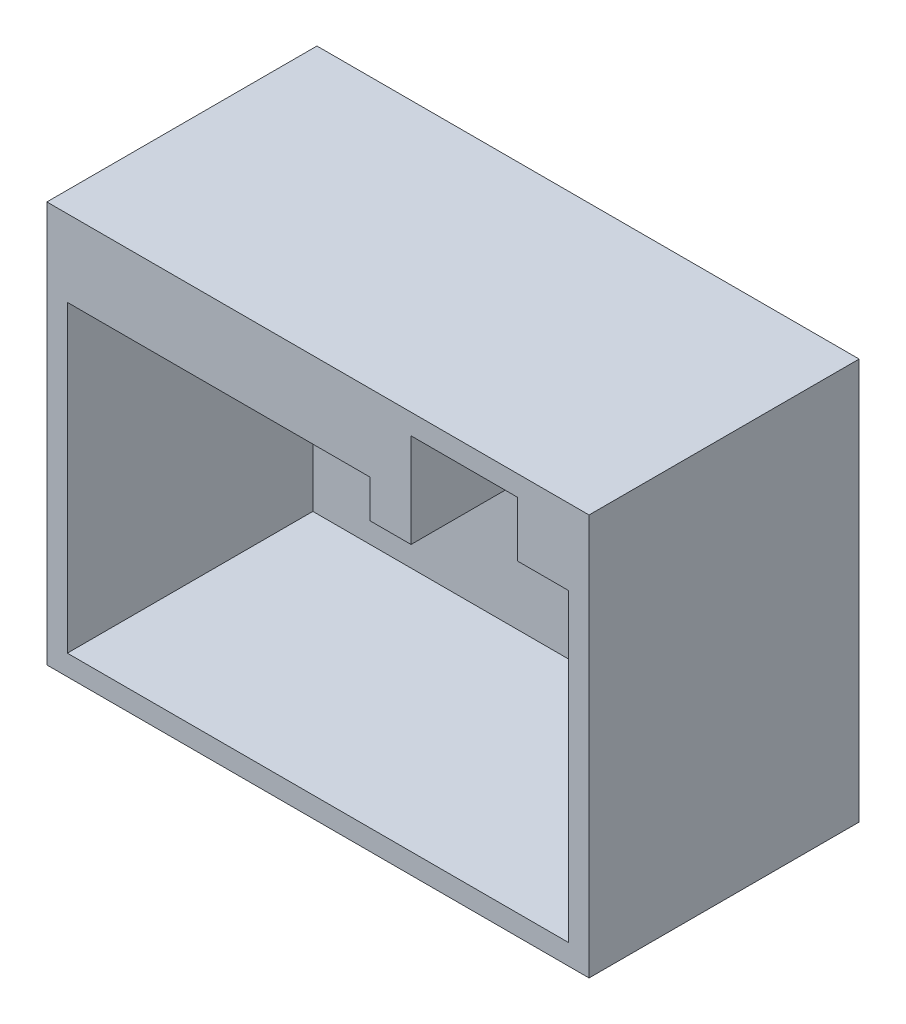
from build123d import *

# Parameters (mm, degrees)
EXTRUDE_THIN1_DEPTH      = 3048
EXTRUDE_THIN1_DEPTH_BACK = 304.8
SKETCH1_W                = 6731
SKETCH1_H                = 4978.4
SKETCH1_W_2              = 6223
SKETCH1_H_2              = 4470.4
SKETCH1_4_W              = 3759.2
SKETCH1_4_H              = 698.5
SKETCH1_4_W_2            = 635
SKETCH1_4_H_2            = 685.8
BOSS_EXTRUDE1_DEPTH      = 304.8
SKETCH1_5_W              = 3759.2
SKETCH1_5_H              = 698.5
SKETCH1_5_W_2            = 635
SKETCH1_5_H_2            = 685.8
BOSS_EXTRUDE2_DEPTH      = 3048


with BuildPart() as part:
    # Sketch1 → Extrude-Thin1 (new, two sides: drawn at the far end of the back side and taken through both)
    with BuildSketch(Plane.XY.offset(-EXTRUDE_THIN1_DEPTH_BACK)):
        with Locations((3111.5, 2235.2)):
            Rectangle(SKETCH1_W, SKETCH1_H)
        with Locations((3111.5, 2235.2)):
            Rectangle(SKETCH1_W_2, SKETCH1_H_2, mode=Mode.SUBTRACT)
    extrude(amount=EXTRUDE_THIN1_DEPTH + EXTRUDE_THIN1_DEPTH_BACK)

    # Sketch1<4> → Boss-Extrude1 (add)
    with BuildSketch(Plane.XY):
        Polygon((5588, 3784.6), (5588, 4470.4), (4267.2, 4470.4), (4267.2, 3302), (3759.2, 3302), (3759.2, 3771.9), (0, 3771.9), (0, 0), (6223, 0), (6223, 3784.6), align=None)
        with Locations((1879.6, 4121.15)):
            Rectangle(SKETCH1_4_W, SKETCH1_4_H)
        Polygon((4267.2, 3302), (4267.2, 4470.4), (3759.2, 4470.4), (3759.2, 3771.9), (3759.2, 3302), align=None)
        with Locations((5905.5, 4127.5)):
            Rectangle(SKETCH1_4_W_2, SKETCH1_4_H_2)
    extrude(amount=-BOSS_EXTRUDE1_DEPTH)

    # Sketch1<5> → Boss-Extrude2 (add)
    with BuildSketch(Plane.XY):
        with Locations((1879.6, 4121.15)):
            Rectangle(SKETCH1_5_W, SKETCH1_5_H)
        Polygon((4267.2, 3302), (4267.2, 4470.4), (3759.2, 4470.4), (3759.2, 3771.9), (3759.2, 3302), align=None)
        with Locations((5905.5, 4127.5)):
            Rectangle(SKETCH1_5_W_2, SKETCH1_5_H_2)
    extrude(amount=BOSS_EXTRUDE2_DEPTH)


solid = part.part
